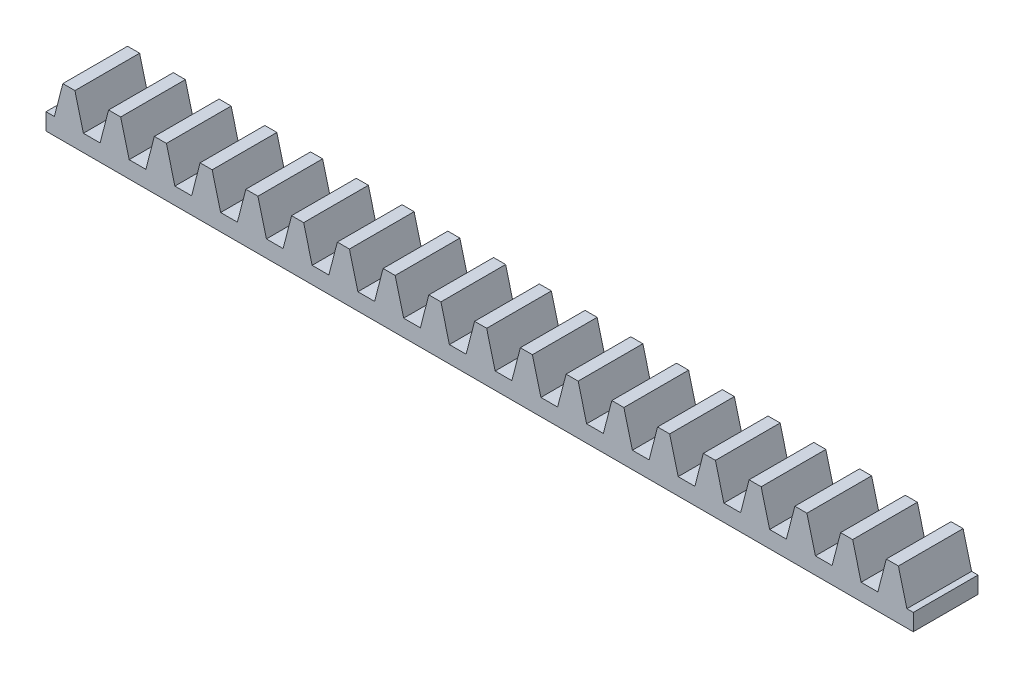
from build123d import *

# Parameters (mm, degrees)
BLANKSKE_W            = 67
BLANKSKE_H            = 5.125
BLANK_DEPTH           = 5
TOOTHCUTSIM_DEPTH     = 68.381493194
TEETHCUTS_COUNT       = 20
TEETHCUTS_PITCH       = 3.534291731
CROQUIS1_W            = 67
CROQUIS1_H            = 1.296875
CORTAR_EXTRUIR1_DEPTH = 10


with BuildPart() as part:
    # BlankSke → Blank (new body)
    with BuildSketch(Plane.XY):
        with Locations((33.5, 2.5625)):
            Rectangle(BLANKSKE_W, BLANKSKE_H)
    extrude(amount=-BLANK_DEPTH)

    # TooCutSkeSim → ToothCutSim (cut, through all)
    with BuildSketch(Plane.XY):
        Polygon((0.645891955, 2.59375), (-0.645891955, 2.59375), (-1.307086602, 5.1504), (1.307086602, 5.1504), align=None)
    toothcutsim = extrude(amount=-TOOTHCUTSIM_DEPTH, mode=Mode.SUBTRACT)

    # TeethCuts: ToothCutSim ×20
    with Locations(*[(i * TEETHCUTS_PITCH, 0, 0) for i in range(1, TEETHCUTS_COUNT)]):
        add(toothcutsim, mode=Mode.SUBTRACT)

    # Croquis1 → Cortar-Extruir1 (cut)
    with BuildSketch(Plane.XY):
        with Locations((33.5, 0.6484375)):
            Rectangle(CROQUIS1_W, CROQUIS1_H)
    extrude(amount=-CORTAR_EXTRUIR1_DEPTH, mode=Mode.SUBTRACT)


solid = part.part
